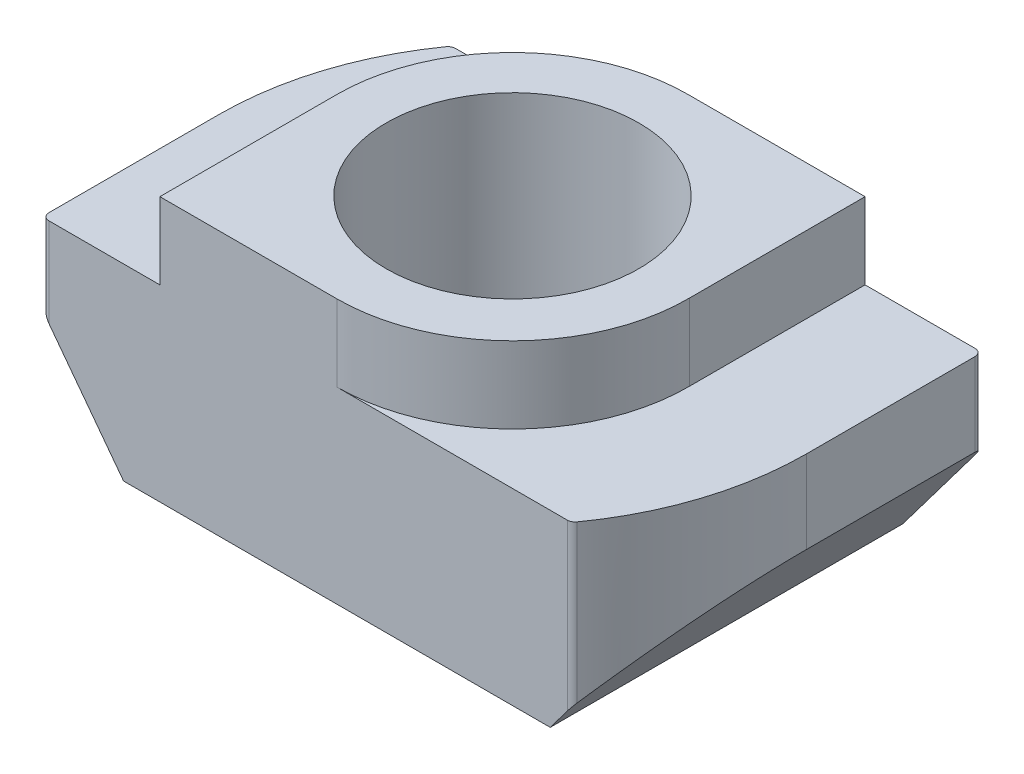
from build123d import *

# Parameters (mm, degrees)
EXTRUDE_1_DEPTH     = 3.2
EXTRUDE_2_DEPTH     = 1.3
CUT_EXTRUDE_1_DEPTH = 4.65
CUT_EXTRUDE_2_REACH = 9.384
SKETCH_4_R          = 2.15


with BuildPart() as part:
    # 草图1 → 凸台-拉伸1 (new body)
    with BuildSketch(Plane(origin=(0, 0, 0), x_dir=(1, 0, 0), z_dir=(0, 1, 0))):
        with BuildLine():
            Line((3.92, -3.012326357), (-4.900543928, -3.012326357))
            ThreePointArc((-4.900543928, -3.012326357), (-4.985396742, -2.97717917), (-5.020543928, -2.892326357))
            Line((-5.020543928, -2.892326357), (-5.020543928, 0))
            ThreePointArc((-5.020543928, 0), (-4.782016181, 1.53758289), (-4.088854807, 2.930631324))
            ThreePointArc((-4.088854807, 2.930631324), (-4.040689897, 2.972567944), (-3.978638656, 2.987673643))
            Line((-3.978638656, 2.987673643), (4.859456072, 2.987673643))
            ThreePointArc((4.859456072, 2.987673643), (4.944308886, 2.952526457), (4.979456072, 2.867673643))
            Line((4.979456072, 2.867673643), (4.979456072, 0))
            ThreePointArc((4.979456072, 0), (4.736196095, -1.552389562), (4.029736524, -2.955957745))
            ThreePointArc((4.029736524, -2.955957745), (3.98168372, -2.997410155), (3.92, -3.012326357))
        make_face()
    extrude(amount=EXTRUDE_1_DEPTH)

    # 草图2 → 凸台-拉伸2 (add)
    with BuildSketch(Plane(origin=(0, 3.2, 0), x_dir=(1, 0, 0), z_dir=(0, 1, 0))):
        with BuildLine():
            Line((0, -3.012326357), (-3.012326357, -3.012326357))
            Line((-3.012326357, -3.012326357), (-3.012326357, 0))
            ThreePointArc((-3.012326357, 0), (-2.128529169, 2.12133825), (0, 2.987673643))
            Line((0, 2.987673643), (2.987673643, 2.987673643))
            Line((2.987673643, 2.987673643), (2.987673643, 0))
            ThreePointArc((2.987673643, 0), (2.12133825, -2.128529169), (0, -3.012326357))
        make_face()
    extrude(amount=EXTRUDE_2_DEPTH)

    # 草图3 → 切除-拉伸1 (cut, symmetric)
    with BuildSketch(Plane.XY):
        Polygon((5.020543928, 0), (3.63, 0), (5.020543928, 1.845314119), align=None)
        Polygon((-3.63, 0), (-5.020543928, 1.845314119), (-5.020543928, 0), align=None)
    extrude(amount=CUT_EXTRUDE_1_DEPTH, both=True, mode=Mode.SUBTRACT)

    # 草图4 → 切除-拉伸2 (cut, up to next)
    with BuildSketch(Plane(origin=(0, 4.5, 0), x_dir=(1, 0, 0), z_dir=(0, 1, 0)), mode=Mode.PRIVATE) as cut_extrude_2_sk1:
        with Locations(Location((-0.024551835, 0, 0), (0, 0, 270))):
            Circle(SKETCH_4_R)
    cut_extrude_2_tool1 = extrude(cut_extrude_2_sk1.sketch, amount=-CUT_EXTRUDE_2_REACH, mode=Mode.PRIVATE) & part.part
    add(cut_extrude_2_tool1.solids().sort_by_distance((-0.024552, 4.5, 0))[0], mode=Mode.SUBTRACT)


solid = part.part
